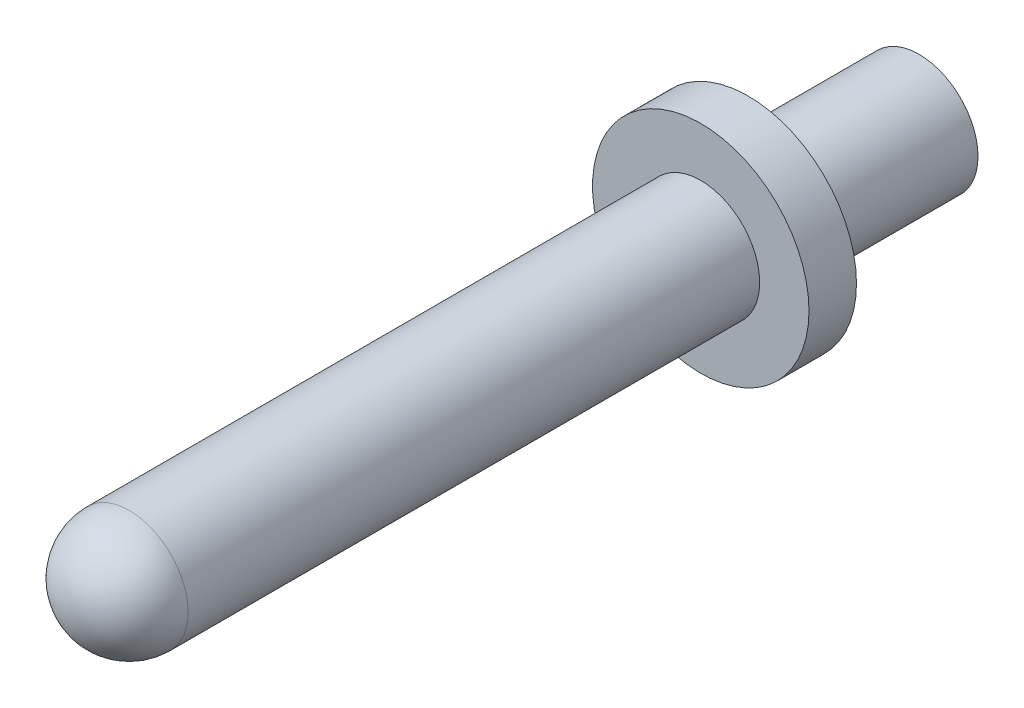
from build123d import *
from build123d.topology import SkipClean

# Parameters (mm, degrees)
SKETCH1_W = 0.2413
SKETCH1_H = 2.286


with BuildPart() as part:
    # Sketch1 → Revolve1 (revolve)
    with SkipClean():  # the faces are left unmerged after this step: merging them gives an invalid solid
        with BuildSketch(Plane(origin=(0, 0, 0), x_dir=(1, 0, 0), z_dir=(0, 1, 0))):
            with BuildLine():
                ThreePointArc((0.7874, 0.7874), (0.55677588, 1.34417588), (0, 1.5748))
                Line((0, 1.5748), (0, 0))
                ThreePointArc((0, 0), (0.55677588, 0.23062412), (0.7874, 0.7874))
            make_face()
            with BuildLine():
                Line((0, 0), (0, 1.5748))
                ThreePointArc((0, 1.5748), (-0.7874, 0.7874), (0, 0))
            make_face()
            with BuildLine():
                Line((0.7874, 8.4328), (0, 8.4328))
                Line((0, 8.4328), (0, 1.5748))
                ThreePointArc((0, 1.5748), (0.55677588, 1.34417588), (0.7874, 0.7874))
                Line((0.7874, 0.7874), (0.7874, 8.4328))
            make_face()
            Polygon((0.7874, 9.0678), (0.5461, 9.0678), (0, 8.7503), (0, 8.4328), (0.7874, 8.4328), (1.4478, 8.4328), (1.4478, 9.0678), align=None)
            with Locations((0.66675, 10.2108)):
                Rectangle(SKETCH1_W, SKETCH1_H)
        revolve(axis=Axis((0, 0, 0), (0, 0, -1)))


solid = part.part
